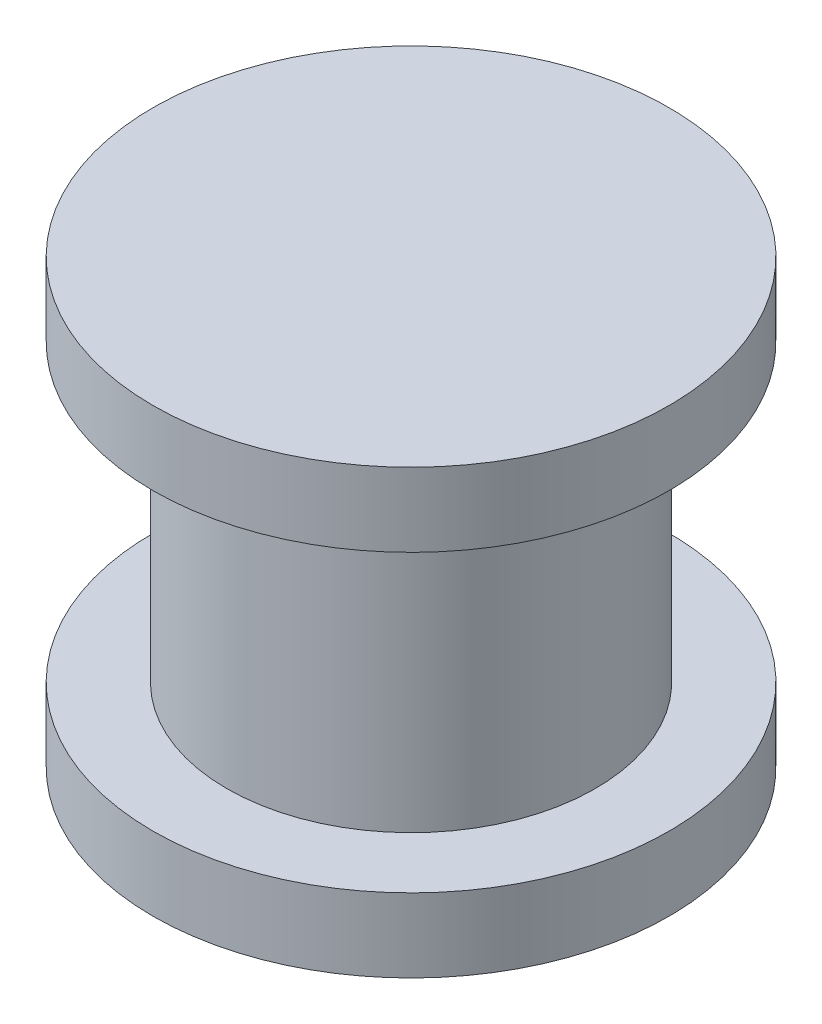
from build123d import *


with BuildPart() as part:
    # Sketch1 → Revolve1 (revolve)
    with BuildSketch(Plane.XY):
        Polygon((4.445, 3.81), (0, 3.81), (0, -3.81), (4.445, -3.81), (4.445, -2.54), (3.175, -2.54), (3.175, 2.54), (4.445, 2.54), align=None)
    revolve(axis=Axis((0, 55, 0), (0, -1, 0)))


solid = part.part
